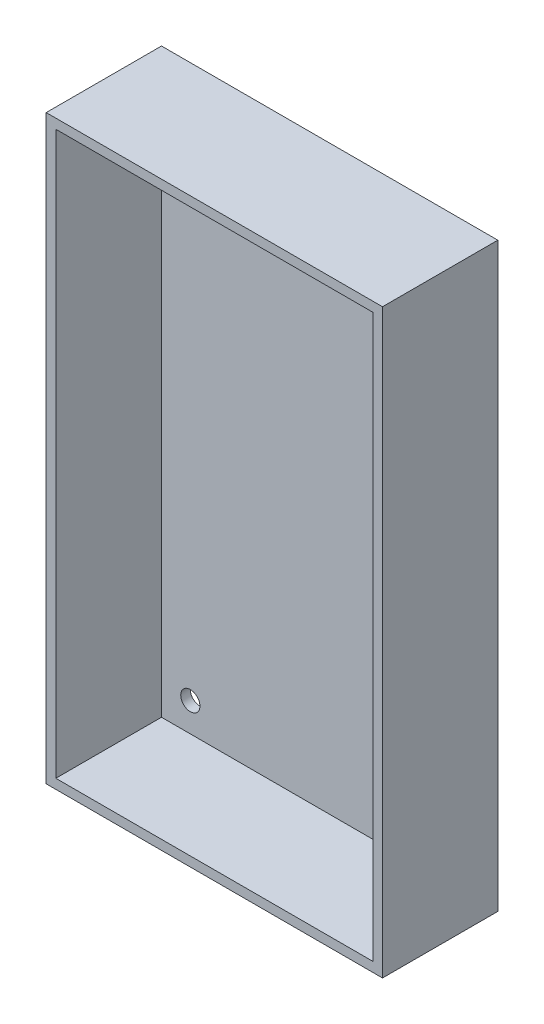
from build123d import *

# Parameters (mm, degrees)
CROQUIS1_W              = 70
CROQUIS1_H              = 121
SALIENTE_EXTRUIR1_DEPTH = 2
CROQUIS2_W              = 70
CROQUIS2_H              = 121
CROQUIS2_W_2            = 66
CROQUIS2_H_2            = 117
SALIENTE_EXTRUIR2_DEPTH = 22
CROQUIS3_R              = 2
CORTAR_EXTRUIR1_DEPTH   = 10


with BuildPart() as part:
    # Croquis1 → Saliente-Extruir1 (new body)
    with BuildSketch(Plane.XY):
        Rectangle(CROQUIS1_W, CROQUIS1_H)
    extrude(amount=SALIENTE_EXTRUIR1_DEPTH)

    # Croquis2 → Saliente-Extruir2 (add)
    with BuildSketch(Plane.XY.offset(2)):
        Rectangle(CROQUIS2_W, CROQUIS2_H)
        Rectangle(CROQUIS2_W_2, CROQUIS2_H_2, mode=Mode.SUBTRACT)
    extrude(amount=SALIENTE_EXTRUIR2_DEPTH)

    # Croquis3 → Cortar-Extruir1 (cut)
    with BuildSketch(Plane(origin=(0, 0, 0), x_dir=(-1, 0, 0), z_dir=(0, 0, -1))):
        with Locations((-27, 52.5)):
            Circle(CROQUIS3_R)
        with Locations((-27, -52.5)):
            Circle(CROQUIS3_R)
        with Locations((27, -52.5)):
            Circle(CROQUIS3_R)
        with Locations((27, 52.5)):
            Circle(CROQUIS3_R)
    extrude(amount=-CORTAR_EXTRUIR1_DEPTH, mode=Mode.SUBTRACT)


solid = part.part
